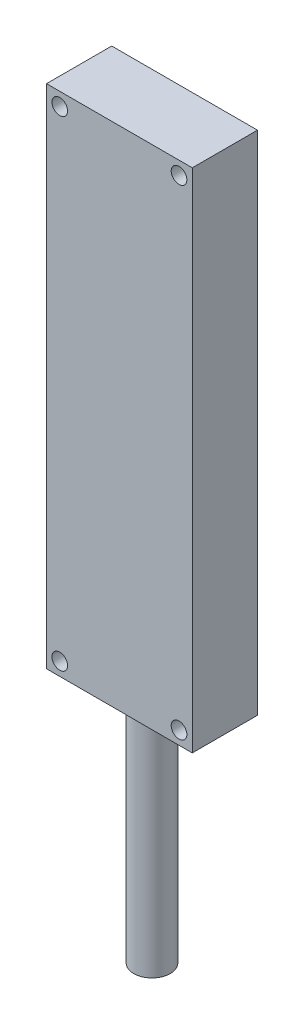
from build123d import *

# Parameters (mm, degrees)
SKETCH1_W           = 27.94
SKETCH1_H           = 97.14
BOSS_EXTRUDE1_DEPTH = 12.5
SKETCH2_R           = 1.5
CUT_EXTRUDE1_DEPTH  = 23
SKETCH3_R           = 3.5
BOSS_EXTRUDE2_DEPTH = 45


with BuildPart() as part:
    # Sketch1 → Boss-Extrude1 (new body)
    with BuildSketch(Plane.XY):
        Rectangle(SKETCH1_W, SKETCH1_H)
    extrude(amount=BOSS_EXTRUDE1_DEPTH)

    # Sketch2 → Cut-Extrude1 (cut)
    with BuildSketch(Plane(origin=(0, 0, 0), x_dir=(-1, 0, 0), z_dir=(0, 0, -1))):
        with Locations((-11.43, 46.04)):
            Circle(SKETCH2_R)
        with Locations((-11.43, -46.04)):
            Circle(SKETCH2_R)
        with Locations((11.43, 46.04)):
            Circle(SKETCH2_R)
        with Locations((11.43, -46.04)):
            Circle(SKETCH2_R)
    extrude(amount=-CUT_EXTRUDE1_DEPTH, mode=Mode.SUBTRACT)

    # Sketch3 → Boss-Extrude2 (add)
    with BuildSketch(Plane.XZ.offset(48.57)):
        with Locations(Location((0, 6.25, 0), (0, 0, 90))):
            Circle(SKETCH3_R)
    extrude(amount=BOSS_EXTRUDE2_DEPTH)


solid = part.part
